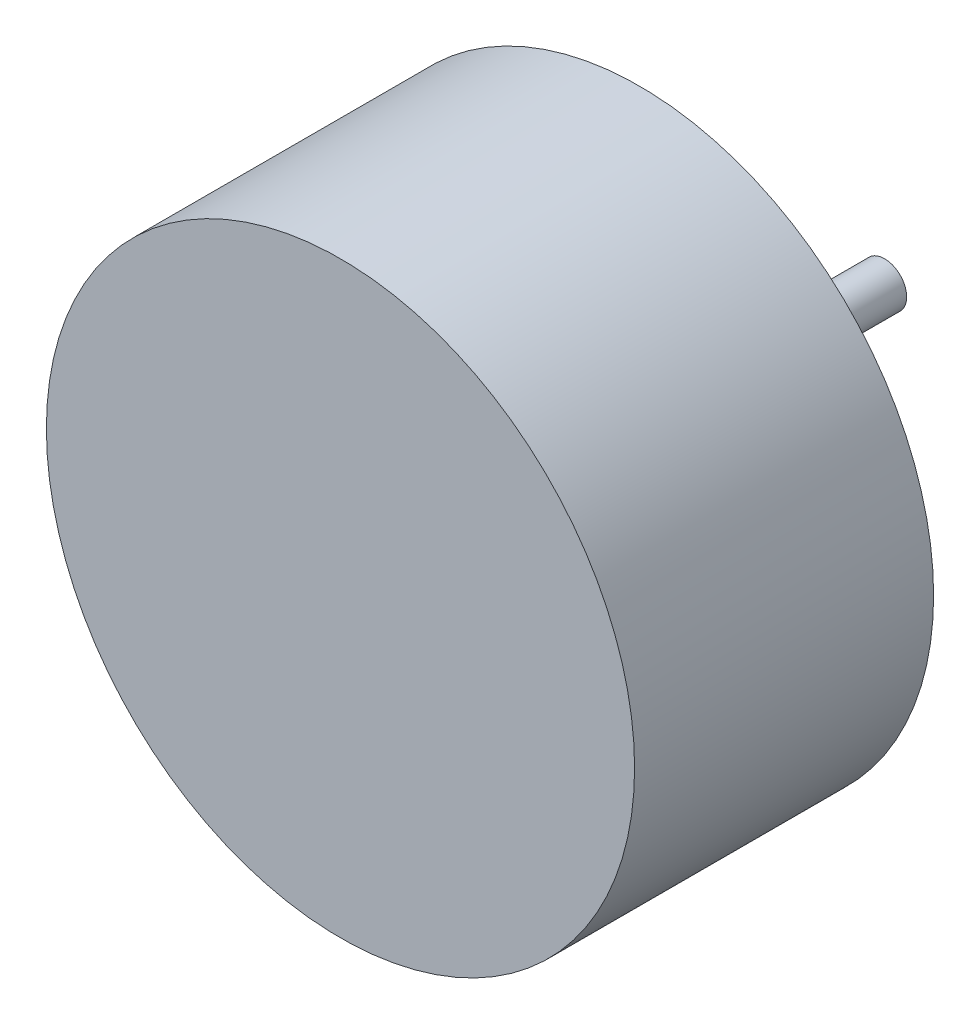
from build123d import *

# Parameters (mm, degrees)
SKETCH_1_R      = 12
EXTRUDE_1_DEPTH = 12.2
SKETCH_2_R      = 0.9
EXTRUDE_2_DEPTH = 10


with BuildPart() as part:
    # 草图1 → 凸台-拉伸1 (new body)
    with BuildSketch(Plane.XY):
        Circle(SKETCH_1_R)
    extrude(amount=EXTRUDE_1_DEPTH)

    # 草图2 → 凸台-拉伸2 (add)
    with BuildSketch(Plane(origin=(0, 0, 0), x_dir=(-1, 0, 0), z_dir=(0, 0, -1))):
        with Locations(Location((0, 0, 0), (0, 0, 180))):
            Circle(SKETCH_2_R)
    extrude(amount=EXTRUDE_2_DEPTH)


solid = part.part
